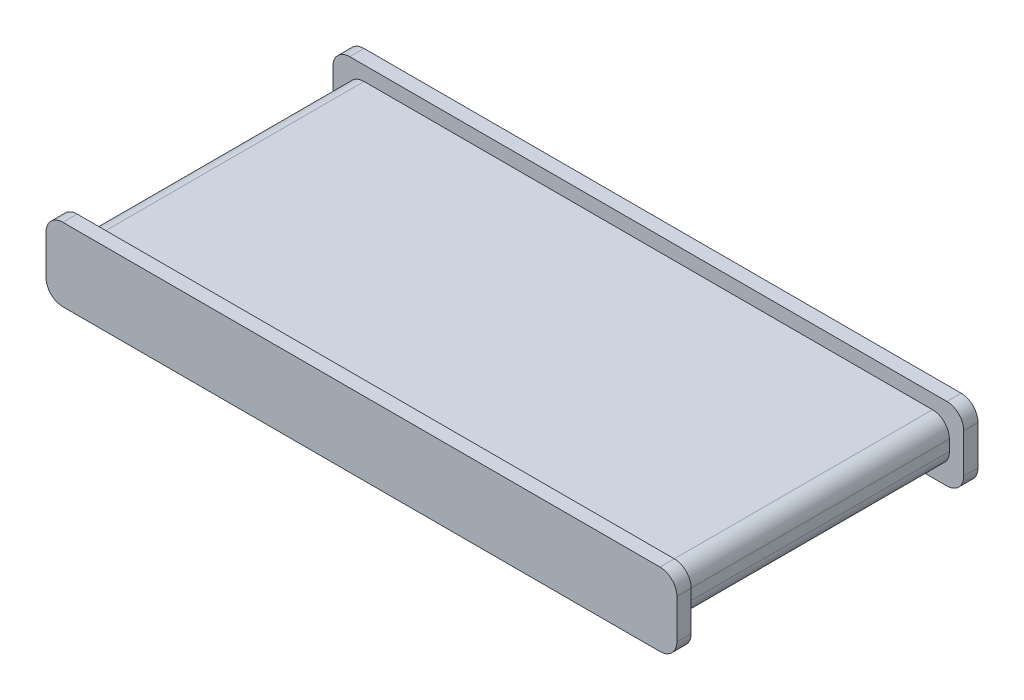
from build123d import *

# Parameters (mm, degrees)
SKETCH2_W           = 107
SKETCH2_H           = 7.924066875
BOSS_EXTRUDE1_DEPTH = 48.42
FILLET1_R           = 3
SKETCH3_W           = 112.08
SKETCH3_H           = 13.004066875
BOSS_EXTRUDE2_DEPTH = 2.54
SKETCH4_W           = 112.08
SKETCH4_H           = 13.004066875
BOSS_EXTRUDE3_DEPTH = 2.54
FILLET2_R           = 3


with BuildPart() as part:
    # Sketch2 → Boss-Extrude1 (new body)
    with BuildSketch(Plane.XY):
        with Locations((53.5, 3.962033438)):
            Rectangle(SKETCH2_W, SKETCH2_H)
    extrude(amount=BOSS_EXTRUDE1_DEPTH)

    # Fillet1
    fillet1_edges = [part.edges().sort_by_distance(p)[0] for p in [
        (0, 0, 24.21),
        (0, 7.924066875, 24.21),
        (107, 7.924066875, 24.21),
        (107, 0, 24.21),
    ]]
    fillet(fillet1_edges, radius=FILLET1_R)

    # Sketch3 → Boss-Extrude2 (add)
    with BuildSketch(Plane.XY.offset(48.42)):
        with Locations((53.5, 3.962033438)):
            Rectangle(SKETCH3_W, SKETCH3_H)
    extrude(amount=BOSS_EXTRUDE2_DEPTH)

    # Sketch4 → Boss-Extrude3 (add)
    with BuildSketch(Plane(origin=(0, 0, 0), x_dir=(-1, 0, 0), z_dir=(0, 0, -1))):
        with Locations((-53.5, 3.962033438)):
            Rectangle(SKETCH4_W, SKETCH4_H)
    extrude(amount=BOSS_EXTRUDE3_DEPTH)

    # Fillet2
    fillet2_edges = [part.edges().sort_by_distance(p)[0] for p in [
        (-2.54, 10.464066875, 49.69),
        (-2.54, -2.54, 49.69),
        (109.54, -2.54, 49.69),
        (109.54, 10.464066875, 49.69),
        (109.54, 10.464066875, -1.27),
        (109.54, -2.54, -1.27),
        (-2.54, -2.54, -1.27),
        (-2.54, 10.464066875, -1.27),
    ]]
    fillet(fillet2_edges, radius=FILLET2_R)


solid = part.part
